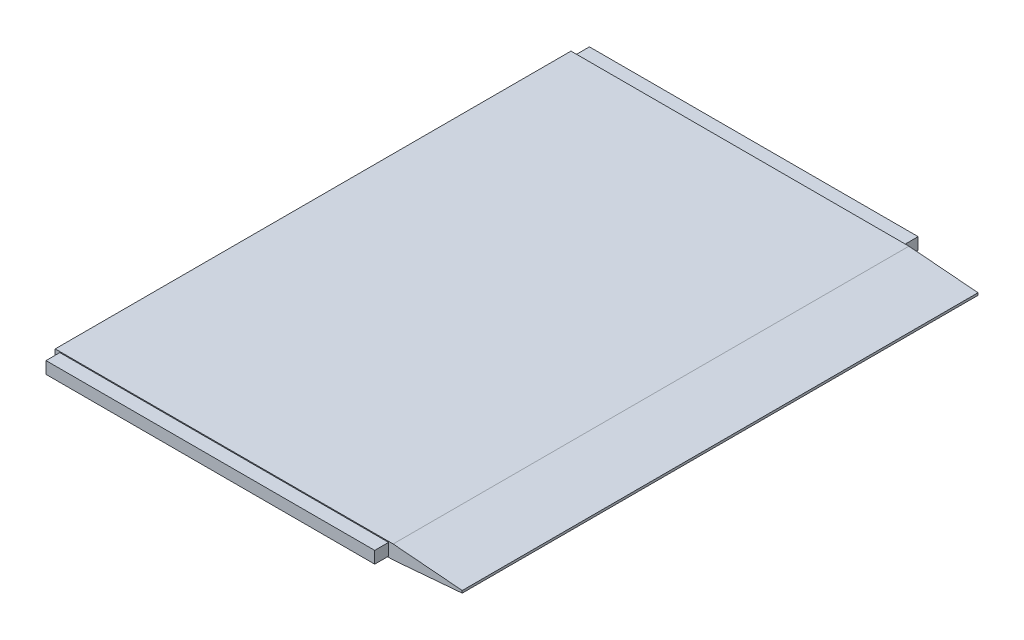
from build123d import *

# Parameters (mm, degrees)
BODY_DEPTH     = 112
SKETCH2_W      = 71.382300335
SKETCH2_H      = 2.6
TAB_LOW_DEPTH  = 3
SKETCH3_W      = 71.382300335
SKETCH3_H      = 2.6
TAB_HIGH_DEPTH = 3


with BuildPart() as part:
    # Sketch1 → Body (new body)
    with BuildSketch(Plane.XY.offset(3)):
        Polygon((26.524366133, -97.918141453), (99.906666468, -97.918141453), (114.906666468, -96.668141453), (114.906666468, -96.168141453), (99.906666468, -94.918141453), (26.524366133, -94.918141453), align=None)
    extrude(amount=BODY_DEPTH)

    # Sketch2 → Tab_low (add)
    with BuildSketch(Plane.XY):
        with Locations((63.215516301, -96.418141453)):
            Rectangle(SKETCH2_W, SKETCH2_H)
    extrude(amount=TAB_LOW_DEPTH)

    # Sketch3 → Tab_high (add)
    with BuildSketch(Plane.XY.offset(115)):
        with Locations((63.215516301, -96.418141453)):
            Rectangle(SKETCH3_W, SKETCH3_H)
    extrude(amount=TAB_HIGH_DEPTH)


solid = part.part
